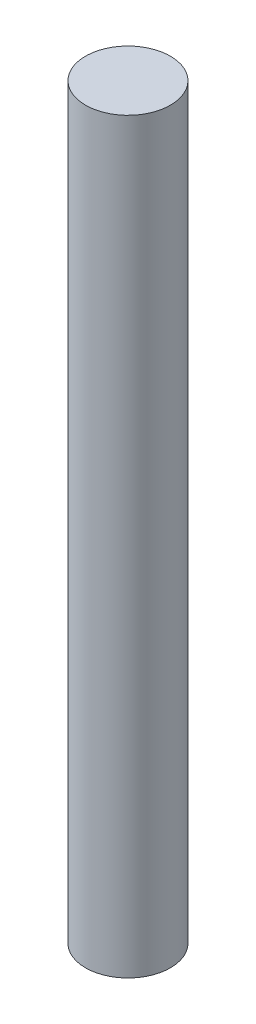
from build123d import *

# Parameters (mm, degrees)
SKETCH1_R           = 1.25
BOSS_EXTRUDE1_DEPTH = 22


with BuildPart() as part:
    # Sketch1 → Boss-Extrude1 (new body)
    with BuildSketch(Plane(origin=(0, 0, 0), x_dir=(1, 0, 0), z_dir=(0, 1, 0))):
        with Locations(Location((0, 0, 0), (0, 0, 270))):
            Circle(SKETCH1_R)
    extrude(amount=BOSS_EXTRUDE1_DEPTH)


solid = part.part
